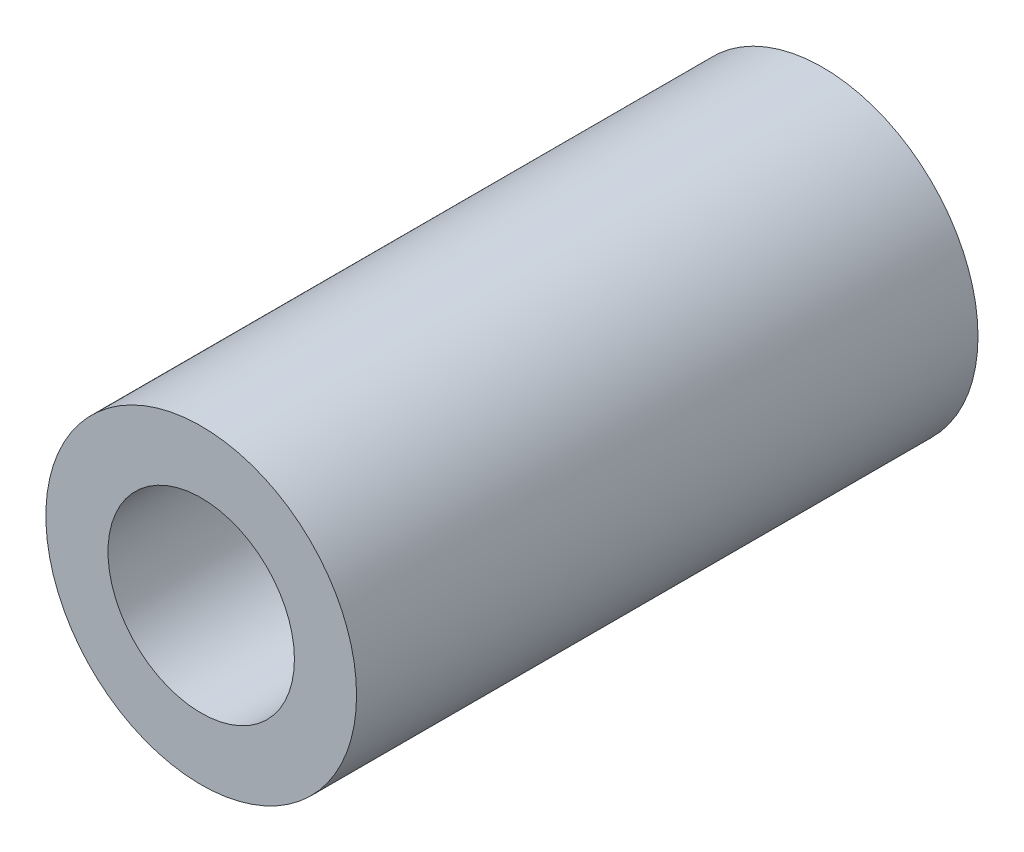
from build123d import *

# Parameters (mm, degrees)
SKETCH1_R           = 2.5
SKETCH1_R_2         = 1.5
BOSS_EXTRUDE1_DEPTH = 10


with BuildPart() as part:
    # Sketch1 → Boss-Extrude1 (new body)
    with BuildSketch(Plane.XY):
        Circle(SKETCH1_R)
        Circle(SKETCH1_R_2, mode=Mode.SUBTRACT)
    extrude(amount=BOSS_EXTRUDE1_DEPTH)


solid = part.part
